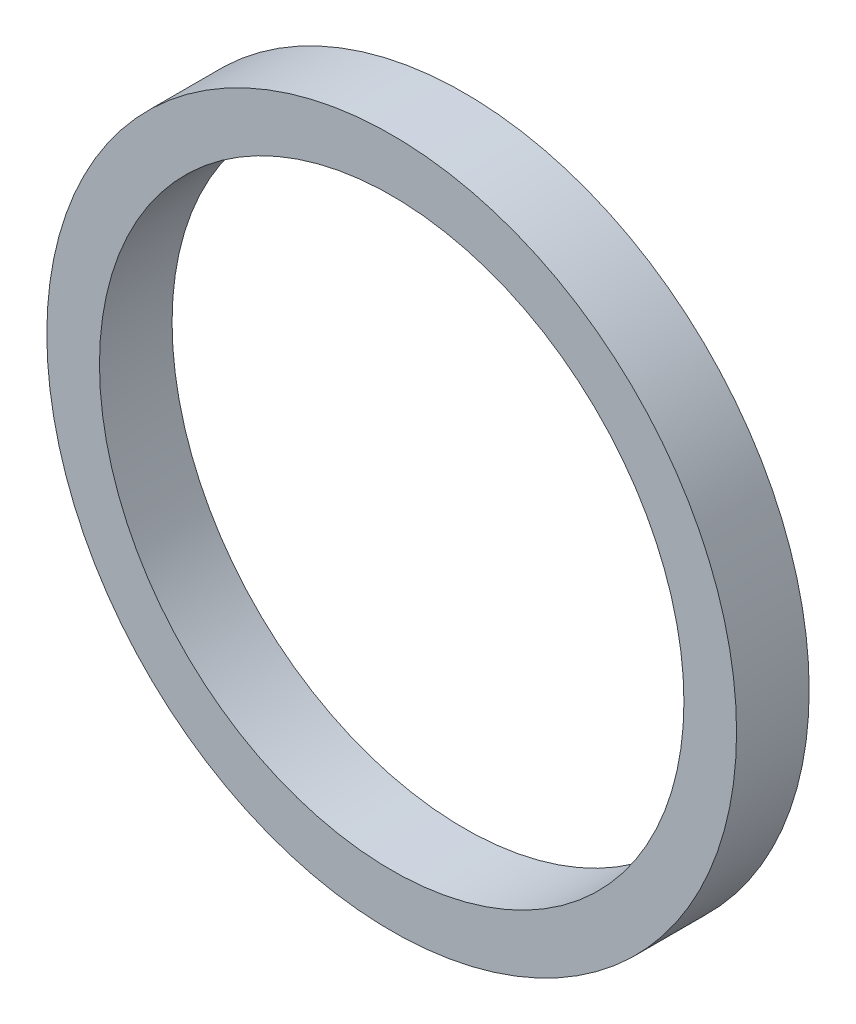
from build123d import *

# Parameters (mm, degrees)
SKETCH1_R           = 9.5
SKETCH1_R_2         = 8.05
BOSS_EXTRUDE1_DEPTH = 2


with BuildPart() as part:
    # Sketch1 → Boss-Extrude1 (new body)
    with BuildSketch(Plane.XY):
        Circle(SKETCH1_R)
        Circle(SKETCH1_R_2, mode=Mode.SUBTRACT)
    extrude(amount=BOSS_EXTRUDE1_DEPTH)


solid = part.part
